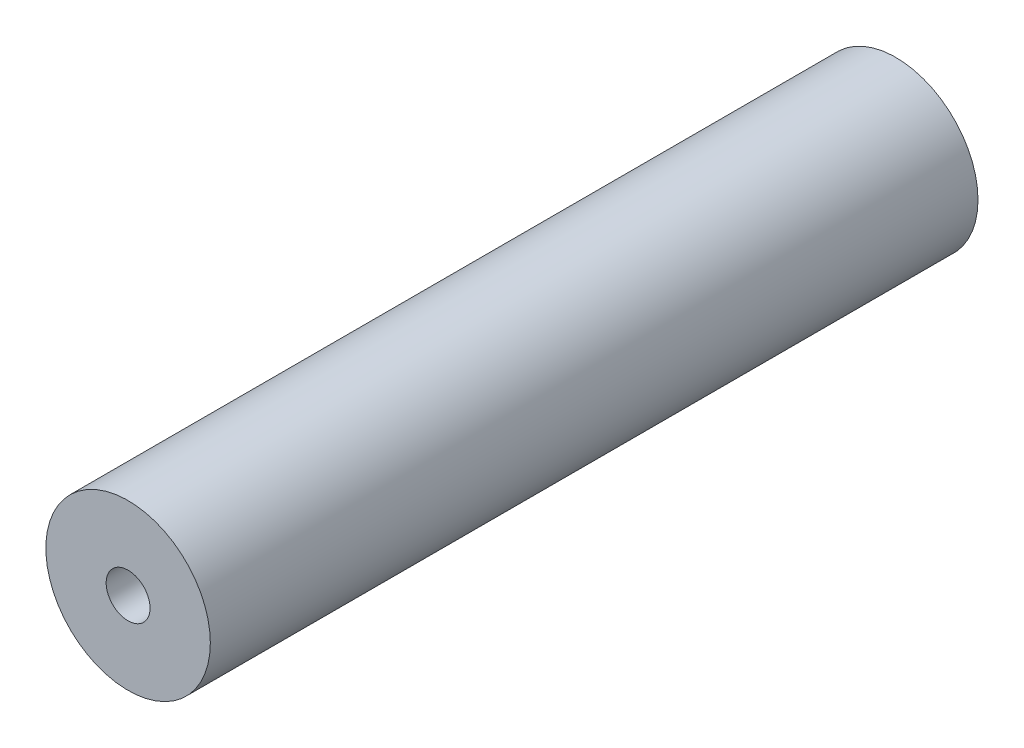
from build123d import *

# Parameters (mm, degrees)
SKETCH1_R           = 4.7625
SKETCH1_R_2         = 1.27
BOSS_EXTRUDE1_DEPTH = 44.45


with BuildPart() as part:
    # Sketch1 → Boss-Extrude1 (new body)
    with BuildSketch(Plane.XY):
        Circle(SKETCH1_R)
        Circle(SKETCH1_R_2, mode=Mode.SUBTRACT)
    extrude(amount=BOSS_EXTRUDE1_DEPTH)


solid = part.part
